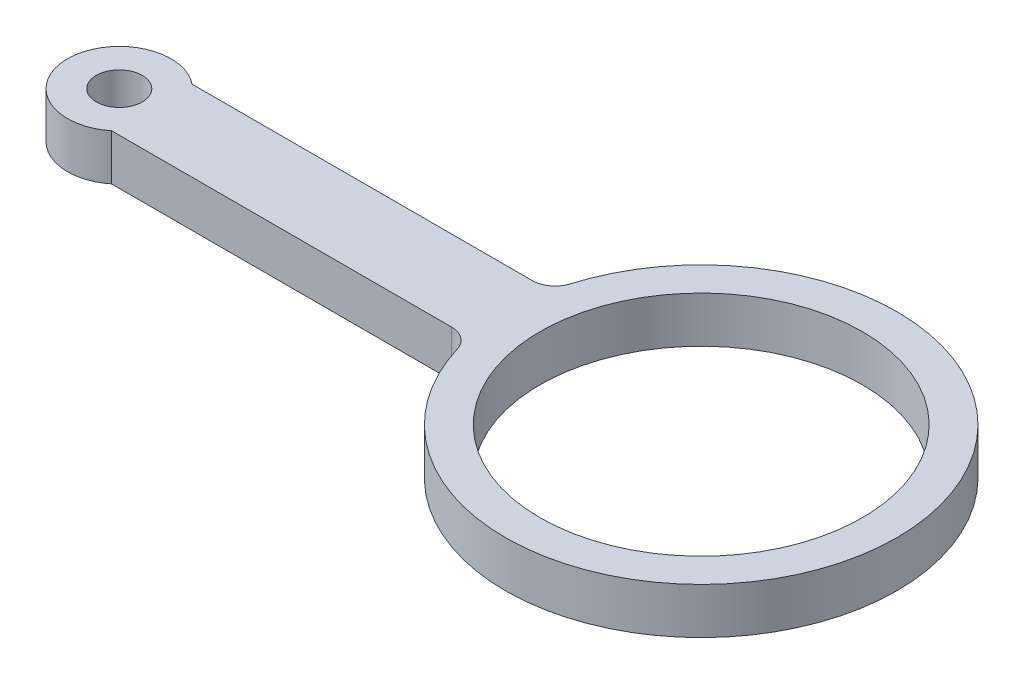
from build123d import *

# Parameters (mm, degrees)
SKETCH1_R           = 7
SKETCH1_R_2         = 1
BOSS_EXTRUDE1_DEPTH = 2


with BuildPart() as part:
    # Sketch1 → Boss-Extrude1 (new body)
    with BuildSketch(Plane(origin=(0, 0, 0), x_dir=(1, 0, 0), z_dir=(0, 1, 0))):
        with BuildLine():
            Line((-6.410211793, -0.565826241), (8.355574645, -0.565826241))
            ThreePointArc((8.355574645, -0.565826241), (8.921122441, -0.390541761), (9.288406736, 0.07386238))
            ThreePointArc((9.288406736, 0.07386238), (25.945574645, -2.315826241), (9.288406736, -4.705514861))
            ThreePointArc((9.288406736, -4.705514861), (8.921122441, -4.24111072), (8.355574645, -4.065826241))
            Line((8.355574645, -4.065826241), (-6.410211793, -4.065826241))
            ThreePointArc((-6.410211793, -4.065826241), (-10.074425355, -2.315826241), (-6.410211793, -0.565826241))
        make_face()
        with Locations(Location((17.445574645, -2.315826241, 0), (0, 0, 270))):
            Circle(SKETCH1_R, mode=Mode.SUBTRACT)
        with Locations(Location((-7.824425355, -2.315826241, 0), (0, 0, 270))):
            Circle(SKETCH1_R_2, mode=Mode.SUBTRACT)
    extrude(amount=BOSS_EXTRUDE1_DEPTH)


solid = part.part
